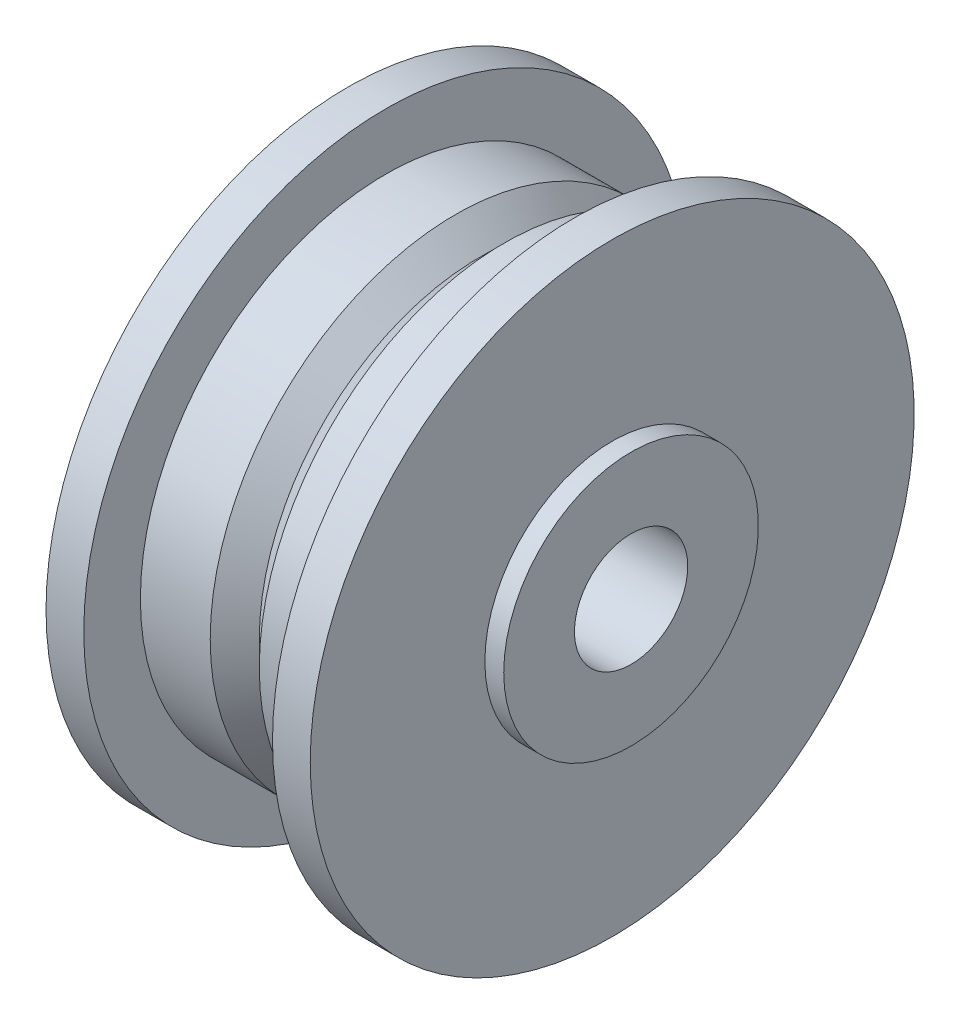
from build123d import *

# Parameters (mm, degrees)
SKETCH2_R          = 30
CUT_EXTRUDE1_DEPTH = 278.128129211


with BuildPart() as part:
    # Sketch1 → Revolve1 (revolve)
    with BuildSketch(Plane.XY, mode=Mode.PRIVATE) as revolve1_sk:
        Polygon((0, 0), (0, 67.475728155), (10, 67.475728155), (10, 160), (30, 160), (30, 130), (67, 130), (80, 117), (93, 130), (130, 130), (130, 160), (150, 160), (150, 67.475728155), (160, 67.475728155), (160, 0), align=None)
    revolve(revolve1_sk.sketch.rotate(Axis((0, 0, 0), (1, 0, 0)), 90), axis=Axis((0, 0, 0), (1, 0, 0)))

    # Sketch2 → Cut-Extrude1 (cut, through all)
    with BuildSketch(Plane(origin=(160, 0, 0), x_dir=(0, 0, -1), z_dir=(1, 0, 0))):
        Circle(SKETCH2_R)
    extrude(amount=-CUT_EXTRUDE1_DEPTH, mode=Mode.SUBTRACT)


solid = part.part
